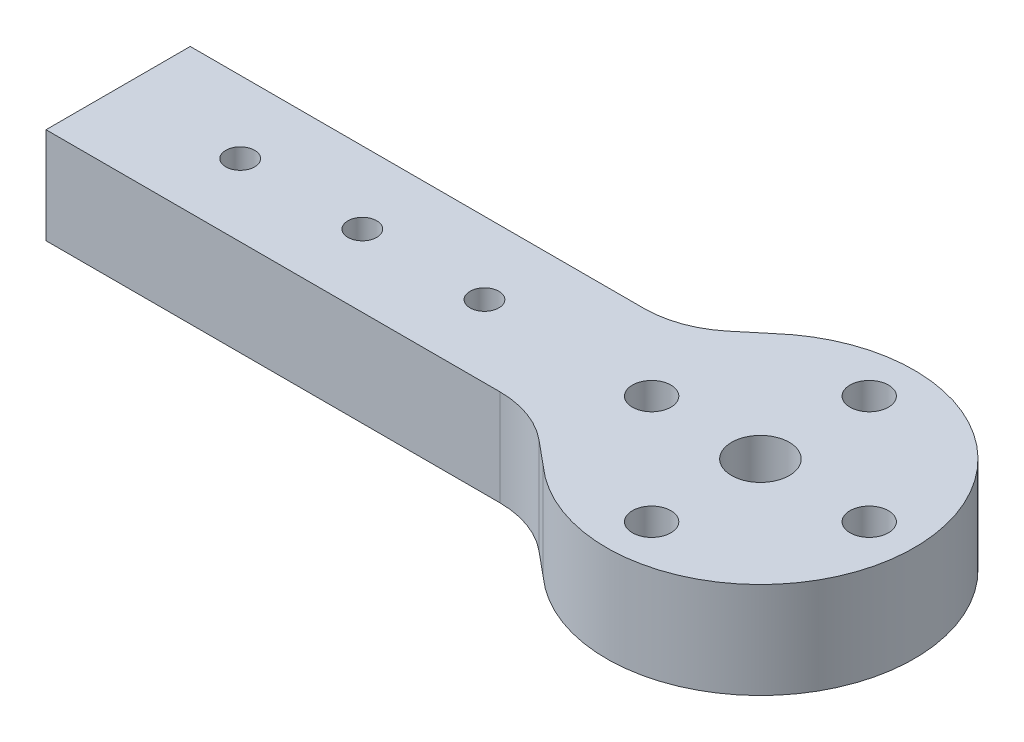
from build123d import *

# Parameters (mm, degrees)
SKETCH1_R           = 1.5
SKETCH1_R_2         = 2
SKETCH1_R_3         = 3
BOSS_EXTRUDE1_DEPTH = 10


with BuildPart() as part:
    # Sketch1 → Boss-Extrude1 (new body)
    with BuildSketch(Plane(origin=(0, 0, 0), x_dir=(1, 0, 0), z_dir=(0, 1, 0))):
        with BuildLine():
            ThreePointArc((53.57700678, 17.304163694), (50.585779575, 15.593662693), (47.191546456, 15))
            Line((47.191546456, 15), (0, 15))
            Line((0, 15), (0, 0))
            Line((0, 0), (47.191546456, 0))
            ThreePointArc((47.191546456, 0), (50.585779575, -0.593662693), (53.57700678, -2.304163694))
            Line((53.57700678, -2.304163694), (56.126078821, -4.419203273))
            ThreePointArc((56.126078821, -4.419203273), (82.8, 7.5), (56.126078821, 19.419203273))
            Line((56.126078821, 19.419203273), (53.57700678, 17.304163694))
        make_face()
        with Locations(Location((12.7, 7.5, 0), (0, 0, 270))):
            Circle(SKETCH1_R, mode=Mode.SUBTRACT)
        with Locations(Location((25.4, 7.5, 0), (0, 0, 270))):
            Circle(SKETCH1_R, mode=Mode.SUBTRACT)
        with Locations(Location((38.1, 7.5, 0), (0, 0, 270))):
            Circle(SKETCH1_R, mode=Mode.SUBTRACT)
        with BuildLine():
            ThreePointArc((53.4862915, 7.5), (55.4862915, 9.5), (57.4862915, 7.5))
            ThreePointArc((57.4862915, 7.5), (55.4862915, 5.5), (53.4862915, 7.5))
        make_face(mode=Mode.SUBTRACT)
        with Locations(Location((66.8, -3.8137085, 0), (0, 0, 270))):
            Circle(SKETCH1_R_2, mode=Mode.SUBTRACT)
        with Locations(Location((66.8, 18.8137085, 0), (0, 0, 270))):
            Circle(SKETCH1_R_2, mode=Mode.SUBTRACT)
        with Locations(Location((78.1137085, 7.5, 0), (0, 0, 270))):
            Circle(SKETCH1_R_2, mode=Mode.SUBTRACT)
        with Locations(Location((66.8, 7.5, 0), (0, 0, 270))):
            Circle(SKETCH1_R_3, mode=Mode.SUBTRACT)
    extrude(amount=BOSS_EXTRUDE1_DEPTH)


solid = part.part
